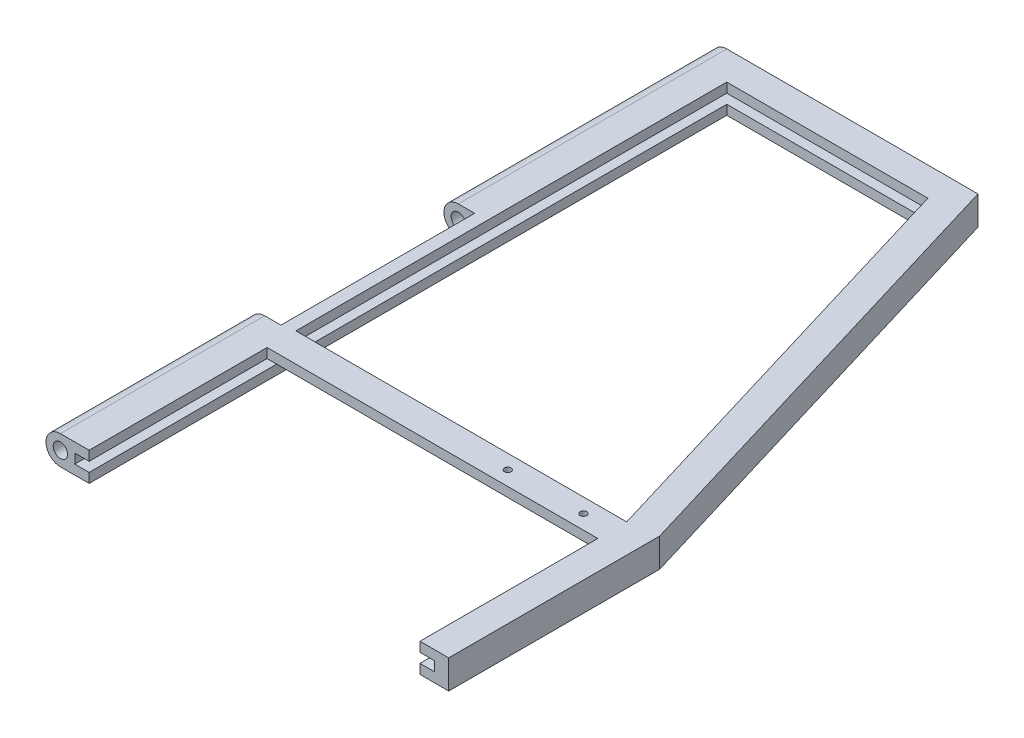
from build123d import *

# Parameters (mm, degrees)
EXTRUDE_1_DEPTH                   = 3
SKETCH_2_R                        = 1.5
SKETCH_2_R_2                      = 0.75
EXTRUDE_2_DEPTH                   = 73
SKETCH_3_W                        = 42
SKETCH_3_H                        = 3.5
SKETCH_3_W_2                      = 3.2
SKETCH_3_H_2                      = 20.2
CUT_EXTRUDE_1_DEPTH               = 83.725086884
CUT_EXTRUDE_2_REACH               = 84.028
CUT_EXTRUDE_2_OFFSET_FROM_SURFACE = 1.5
CUT_EXTRUDE_START                 = -1.5
SKETCH_4_W                        = 44.5
SKETCH_4_H                        = 1
SKETCH_4_3_W                      = 22
SKETCH_4_3_H                      = 1
CUT_EXTRUDE_3_DEPTH               = 37.5
SKETCH_5_W                        = 3
SKETCH_5_H                        = 1
EXTRUDE_3_DEPTH                   = 34.5
SKETCH_6_R                        = 0.35
CUT_EXTRUDE_4_DEPTH               = 80.653562381
SKETCH_7_W                        = 24.036657481
SKETCH_7_H                        = 1
CUT_EXTRUDE_5_DEPTH               = 1.5


with BuildPart() as part:
    # 草图1 → 凸台-拉伸1 (new body)
    with BuildSketch(Plane(origin=(0, 0, 0), x_dir=(1, 0, 0), z_dir=(0, 1, 0))):
        Polygon((0, 0), (0, -73), (38.8, -73), (38.8, -47.5), (24.5, 0), align=None)
    extrude(amount=EXTRUDE_1_DEPTH)

    # 草图2 → 凸台-拉伸2 (add)
    # profile 1 of 2: a face of its own
    with BuildSketch(Plane(origin=(0, 0, 0), x_dir=(-1, 0, 0), z_dir=(0, 0, -1))):
        with BuildLine():
            Line((0, 3), (0, 0))
            Line((0, 0), (1.7, 0))
            ThreePointArc((1.7, 0), (0.2, 1.5), (1.7, 3))
            Line((1.7, 3), (0, 3))
        make_face()
    # profile 2 of 2: a face of its own
    with BuildSketch(Plane(origin=(0, 0, 0), x_dir=(-1, 0, 0), z_dir=(0, 0, -1))):
        with Locations((1.7, 1.5)):
            Circle(SKETCH_2_R)
        with Locations((1.7, 1.5)):
            Circle(SKETCH_2_R_2, mode=Mode.SUBTRACT)
    extrude(amount=-EXTRUDE_2_DEPTH)

    # 草图3 → 切除-拉伸1 (cut, through all)
    with BuildSketch(Plane(origin=(0, 3, 0), x_dir=(1, 0, 0), z_dir=(0, 1, 0))):
        with Locations((17.8, -71.25)):
            Rectangle(SKETCH_3_W, SKETCH_3_H)
        with Locations((-1.6, -38.1)):
            Rectangle(SKETCH_3_W_2, SKETCH_3_H_2)
        Polygon((1.3, -3), (22.270157068, -3), (35.8, -47.941785964), (35.8, -69.5), (1.3, -69.5), align=None)
    extrude(amount=-CUT_EXTRUDE_1_DEPTH, mode=Mode.SUBTRACT)

    # 切除-拉伸2: up to this face of the body (flat: up to its plane, moved by the offset)
    cut_extrude_2_end = Plane(part.part.faces().sort_by_distance((29.035078534, 1.5, 25.470892982))[0]).offset(-CUT_EXTRUDE_2_OFFSET_FROM_SURFACE)
    # 草图4 → 切除-拉伸2 (cut, up to the picked face)
    with BuildSketch(Plane(origin=(1.3, 0, 0), x_dir=(0, 0, -1), z_dir=(1, 0, 0)).offset(CUT_EXTRUDE_START), mode=Mode.PRIVATE) as cut_extrude_2_sk1:
        with Locations((-25.25, 1.5)):
            Rectangle(SKETCH_4_W, SKETCH_4_H)
    cut_extrude_2_tool1 = split(extrude(cut_extrude_2_sk1.sketch, amount=CUT_EXTRUDE_2_REACH, mode=Mode.PRIVATE), bisect_by=cut_extrude_2_end, keep=Keep.BOTH, mode=Mode.PRIVATE)
    add(cut_extrude_2_tool1.solids().sort_by(Axis((-0.2, 1.5, 25.25), (1, 0, 0)))[0], mode=Mode.SUBTRACT)

    # 草图4<3> → 切除-拉伸3 (cut)
    with BuildSketch(Plane(origin=(1.3, 0, 0), x_dir=(0, 0, -1), z_dir=(1, 0, 0)).offset(CUT_EXTRUDE_START)):
        with Locations((-58.5, 1.5)):
            Rectangle(SKETCH_4_3_W, SKETCH_4_3_H)
    extrude(amount=CUT_EXTRUDE_3_DEPTH, mode=Mode.SUBTRACT)

    # 草图5 → 凸台-拉伸3 (add)
    with BuildSketch(Plane.ZY.offset(-35.8)):
        with Locations((49.441785964, 2.5)):
            Rectangle(SKETCH_5_W, SKETCH_5_H)
    extrude(amount=EXTRUDE_3_DEPTH)

    # 草图6 → 切除-拉伸4 (cut, through all)
    with BuildSketch(Plane(origin=(0, 3, 0), x_dir=(1, 0, 0), z_dir=(0, 1, 0))):
        with Locations(Location((32.8, -49.441785964, 0), (0, 0, 270))):
            Circle(SKETCH_6_R)
        with Locations(Location((24.9, -49.441785964, 0), (0, 0, 270))):
            Circle(SKETCH_6_R)
    extrude(amount=-CUT_EXTRUDE_4_DEPTH, mode=Mode.SUBTRACT)

    # 草图7 → 切除-拉伸5 (cut)
    with BuildSketch(Plane.XY.offset(3)):
        with Locations((11.818328741, 1.5)):
            Rectangle(SKETCH_7_W, SKETCH_7_H)
    extrude(amount=-CUT_EXTRUDE_5_DEPTH, mode=Mode.SUBTRACT)


solid = part.part
